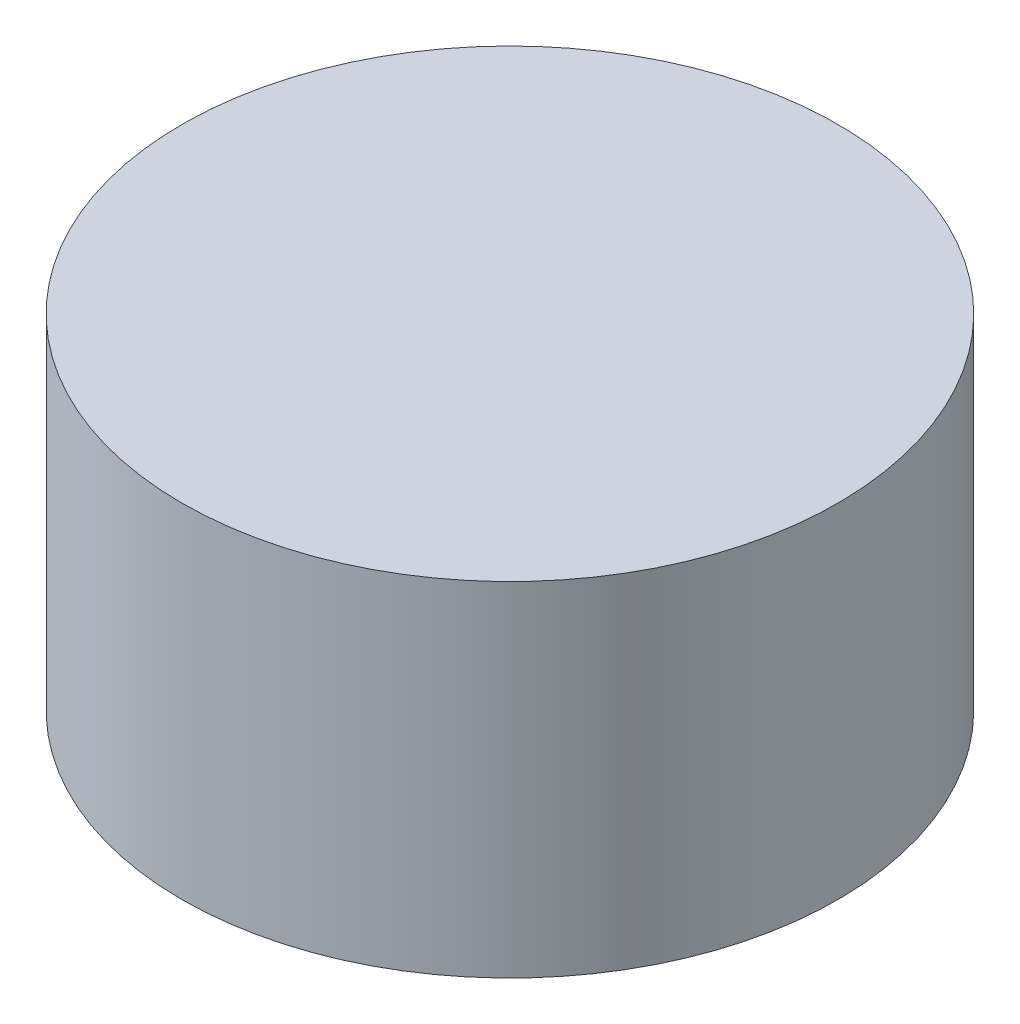
from build123d import *

# Parameters (mm, degrees)
SKETCH1_R           = 24.259441236
BOSS_EXTRUDE1_DEPTH = 25.4


with BuildPart() as part:
    # Sketch1 → Boss-Extrude1 (new body)
    with BuildSketch(Plane(origin=(0, 0, 0), x_dir=(1, 0, 0), z_dir=(0, 1, 0))):
        with Locations(Location((0, 0, 0), (0, 0, 270))):
            Circle(SKETCH1_R)
    extrude(amount=BOSS_EXTRUDE1_DEPTH)


solid = part.part
